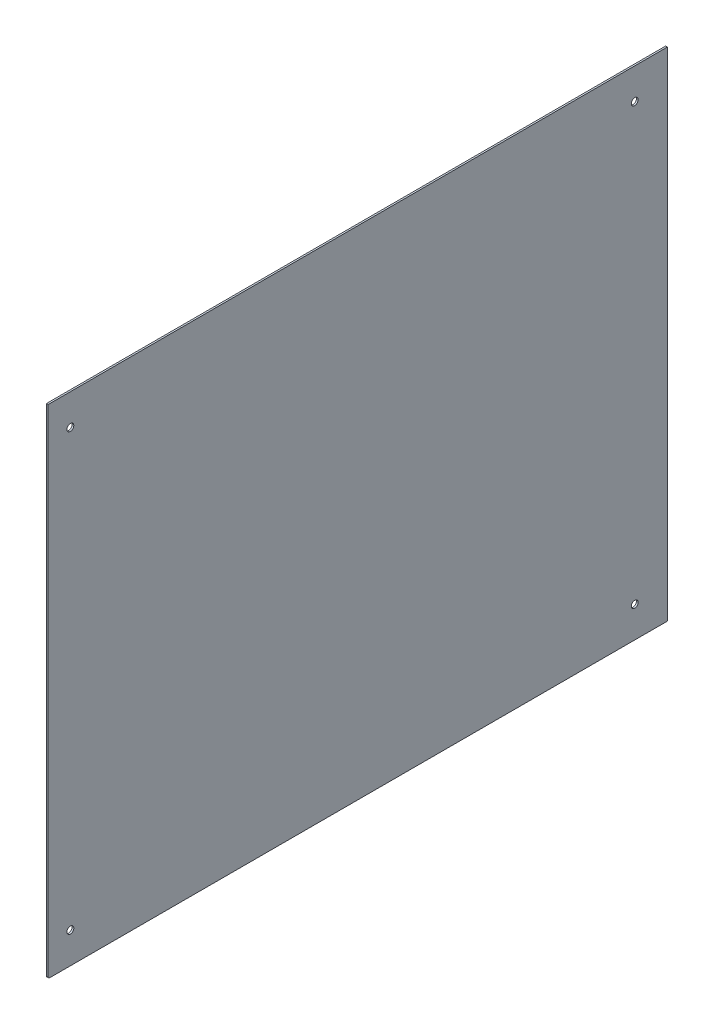
from build123d import *

# Parameters (mm, degrees)
SKETCH1_W           = 360
SKETCH1_H           = 283
SKETCH1_R           = 2
BOSS_EXTRUDE1_DEPTH = 1
SKETCH3_W           = 360.196832798
SKETCH3_H           = 6
BOSS_EXTRUDE2_DEPTH = 1
FILLET1_R           = 1


with BuildPart() as part:
    # Sketch1 → Boss-Extrude1 (new body)
    with BuildSketch(Plane(origin=(0, 0, 0), x_dir=(0, 0, -1), z_dir=(1, 0, 0))):
        Rectangle(SKETCH1_W, SKETCH1_H)
        with Locations((-167, 123.5)):
            Circle(SKETCH1_R, mode=Mode.SUBTRACT)
        with Locations((-167, -129.5)):
            Circle(SKETCH1_R, mode=Mode.SUBTRACT)
        with Locations(Location((161, 123.5, 0), (0, 0, 180))):
            Circle(SKETCH1_R, mode=Mode.SUBTRACT)
        with Locations(Location((161, -129.5, 0), (0, 0, 180))):
            Circle(SKETCH1_R, mode=Mode.SUBTRACT)
    extrude(amount=BOSS_EXTRUDE1_DEPTH)

    # Sketch3 → Boss-Extrude2 (add)
    with BuildSketch(Plane(origin=(1, 0, 0), x_dir=(0, 0, -1), z_dir=(1, 0, 0))):
        with Locations((0.098416399, -144.5)):
            Rectangle(SKETCH3_W, SKETCH3_H)
    extrude(amount=-BOSS_EXTRUDE2_DEPTH)

    # Fillet1
    fillet1_edges = [part.edges().sort_by_distance(p)[0] for p in [
        (0.5, -147.5, 180),
    ]]
    fillet(fillet1_edges, radius=FILLET1_R)


solid = part.part
